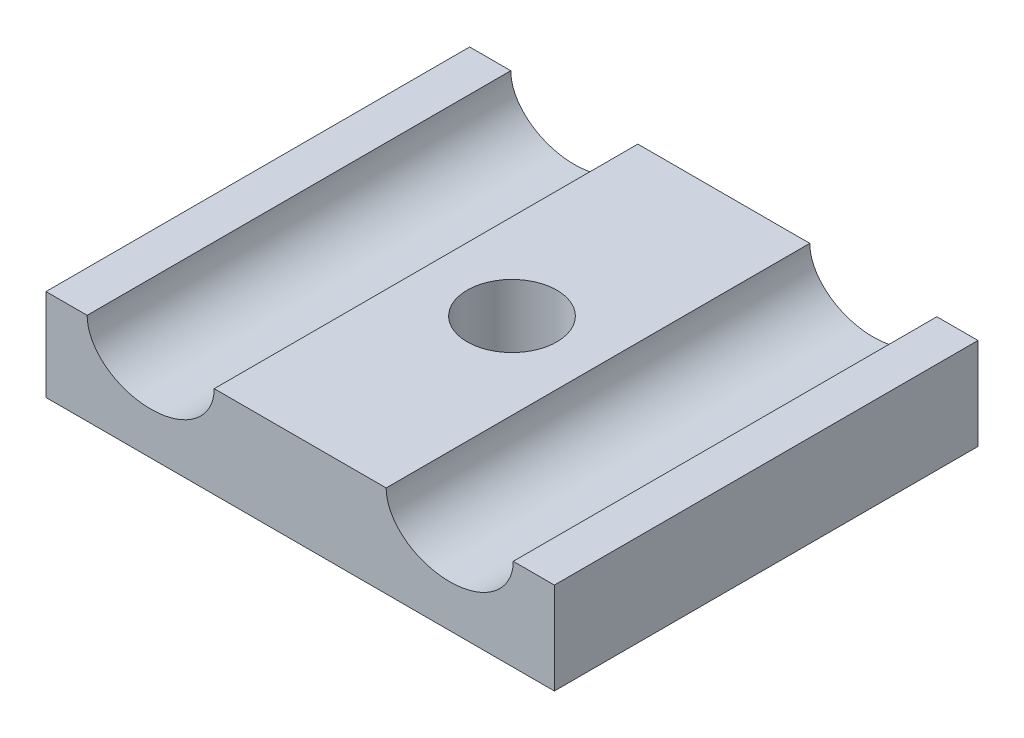
from build123d import *

# Parameters (mm, degrees)
SKETCH1_W           = 36
SKETCH1_H           = 30
BOSS_EXTRUDE1_DEPTH = 6.5
SKETCH2_R           = 3.175
CUT_EXTRUDE1_DEPTH  = 5
SKETCH3_RX          = 4.5
SKETCH3_RY          = 3.5
CUT_EXTRUDE3_DEPTH  = 30


with BuildPart() as part:
    # Sketch1 → Boss-Extrude1 (new body)
    with BuildSketch(Plane(origin=(0, 0, 0), x_dir=(1, 0, 0), z_dir=(0, 1, 0))):
        with Locations((-18, -15)):
            Rectangle(SKETCH1_W, SKETCH1_H)
    extrude(amount=BOSS_EXTRUDE1_DEPTH)

    # Sketch2 → Cut-Extrude1 (cut)
    with BuildSketch(Plane(origin=(0, 6.5, 0), x_dir=(1, 0, 0), z_dir=(0, 1, 0))):
        with Locations(Location((-18, -15, 0), (0, 0, 270))):
            Circle(SKETCH2_R)
    extrude(amount=-CUT_EXTRUDE1_DEPTH, mode=Mode.SUBTRACT)

    # Sketch3 → Cut-Extrude3 (cut)
    with BuildSketch(Plane.XY.offset(30)):
        with Locations(Location((-7.4125, 6.5), (0, 0, -180))):
            Ellipse(SKETCH3_RX, SKETCH3_RY)
        with Locations(Location((-28.5875, 6.5), (0, 0, 0))):
            Ellipse(SKETCH3_RX, SKETCH3_RY)
    extrude(amount=-CUT_EXTRUDE3_DEPTH, mode=Mode.SUBTRACT)


solid = part.part
